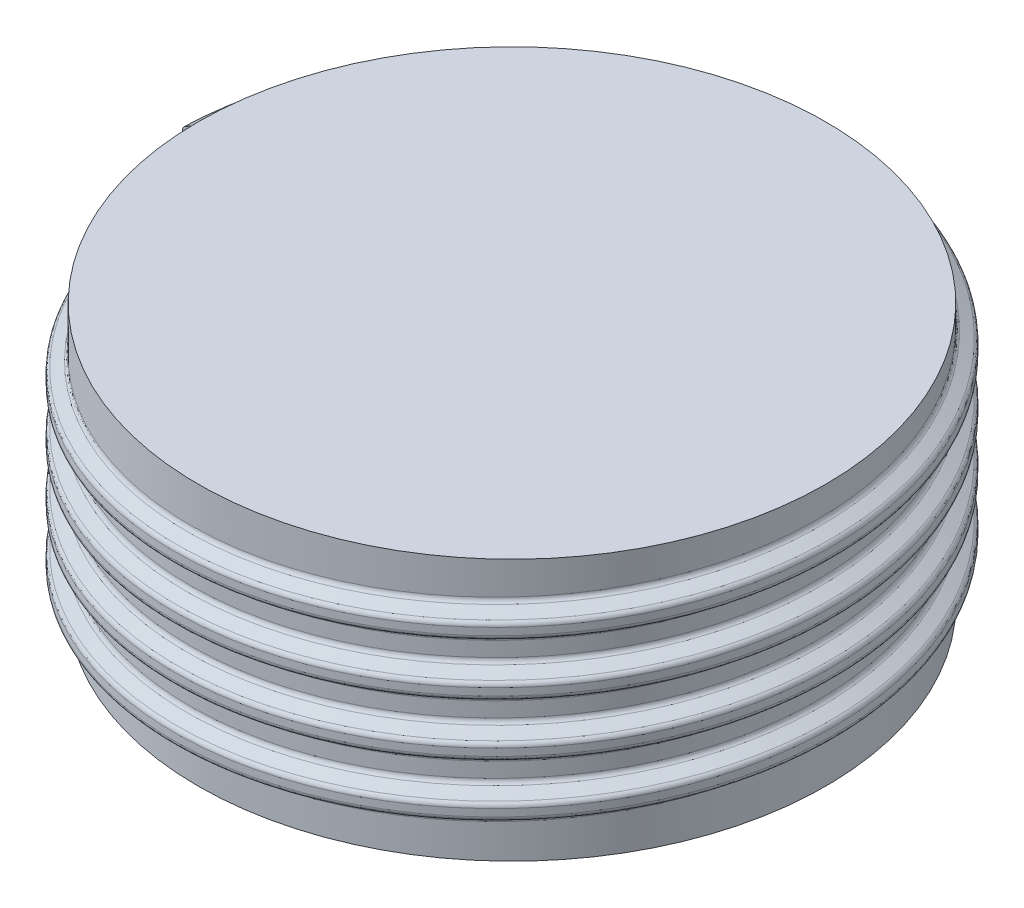
from build123d import *

# Parameters (mm, degrees)
SKETCH1_R           = 30.48
BOSS_EXTRUDE1_DEPTH = 25.4
THREAD1_PITCH       = 5.08
THREAD1_HEIGHT      = 20.32
THREAD1_RADIUS      = 30.48
THREAD1_START_ANGLE = -90


with BuildPart() as part:
    # Sketch1 → Boss-Extrude1 (new body)
    with BuildSketch(Plane(origin=(0, 0, 0), x_dir=(1, 0, 0), z_dir=(0, 1, 0))):
        with Locations(Location((0, 0, 0), (0, 0, 270))):
            Circle(SKETCH1_R)
    extrude(amount=BOSS_EXTRUDE1_DEPTH)

    # Thread1: sweep along a helix
    with BuildLine() as thread1_path:
        add(Helix(THREAD1_PITCH, THREAD1_HEIGHT, THREAD1_RADIUS, center=(0, 25.4, 0), direction=(0, -1, 0), mode=Mode.PRIVATE).rotate(Axis((0, 25.4, 0), (0, -1, 0)), THREAD1_START_ANGLE))
    # Thread Profile2 → Thread1 (sweep)
    with BuildSketch(Plane(origin=(-30.48, 25.4, 0), x_dir=(-1, 0, 0), z_dir=(0, 0, 1))):
        with BuildLine():
            Line((0, 0), (0, 3.634587873))
            ThreePointArc((0, 3.634587873), (0.068059095, 3.380587873), (0.254, 3.194646968))
            Line((0.254, 3.194646968), (1.27, 2.608059095))
            ThreePointArc((1.27, 2.608059095), (1.455940905, 2.42211819), (1.524, 2.16811819))
            Line((1.524, 2.16811819), (1.524, 1.466469684))
            ThreePointArc((1.524, 1.466469684), (1.455940905, 1.212469684), (1.27, 1.026528779))
            Line((1.27, 1.026528779), (0.254, 0.439940905))
            ThreePointArc((0.254, 0.439940905), (0.068059095, 0.254), (0, 0))
        make_face()
    sweep(path=thread1_path.line, is_frenet=True)


solid = part.part
